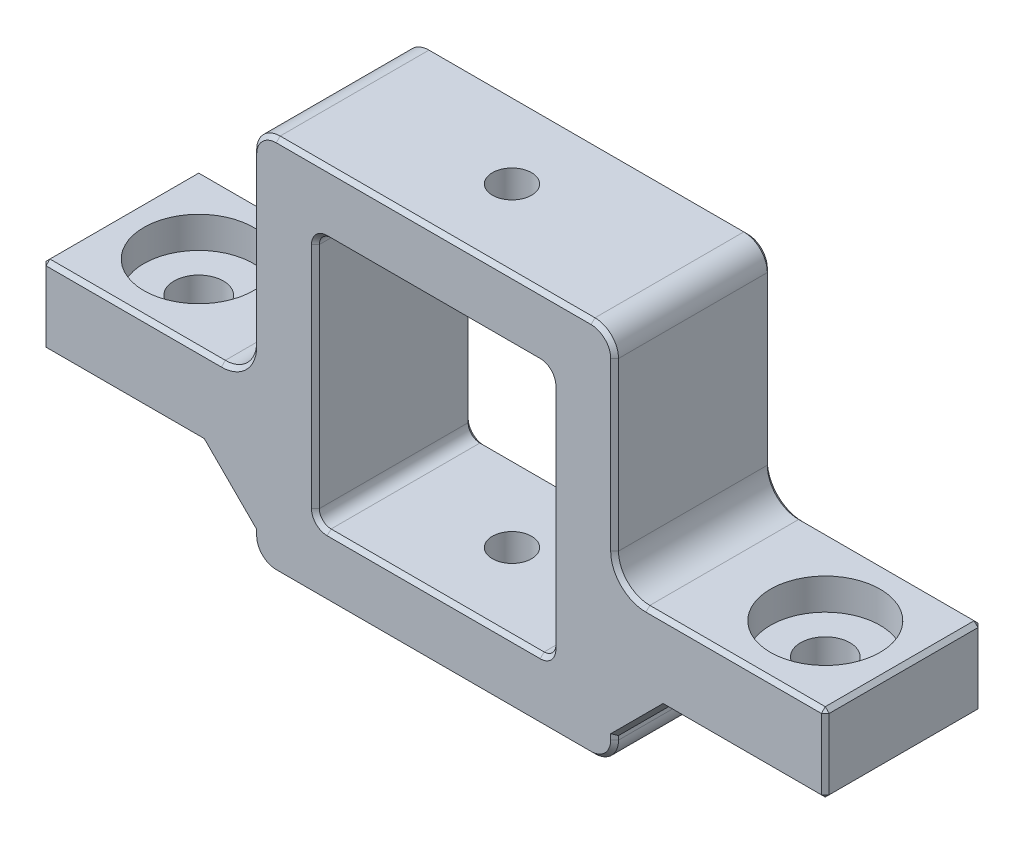
from build123d import *

# Parameters (mm, degrees)
SKETCH1_W           = 30.2
SKETCH1_H           = 32.2
BOSS_EXTRUDE1_DEPTH = 10
FILLET1_R           = 1.5
SKETCH3_R           = 3.15
CUT_EXTRUDE1_DEPTH  = 71.165803637
SKETCH6_W           = 53.8
SKETCH6_H           = 56.6
CUT_EXTRUDE4_DEPTH  = 59.998389809
SKETCH4_R           = 7
CUT_EXTRUDE2_DEPTH  = 32.3
FILLET2_R           = 3
FILLET3_R           = 4
CHAMFER1_SIZE       = 0.5
SKETCH5_R           = 2.5
CUT_EXTRUDE3_DEPTH  = 71.165803637


with BuildPart() as part:
    # Sketch1 → Boss-Extrude1 (new, symmetric)
    with BuildSketch(Plane.XY):
        Polygon((-50, -14.2), (-29.5, -14.2), (-23.1, -20.6), (-23.1, -24.1), (23.1, -24.1), (23.1, -20.6), (29.5, -14.2), (50, -14.2), (50, 24.1), (-50, 24.1), align=None)
        Rectangle(SKETCH1_W, SKETCH1_H, mode=Mode.SUBTRACT)
    extrude(amount=BOSS_EXTRUDE1_DEPTH, both=True)

    # Fillet1
    fillet1_edges = [part.edges().sort_by_distance(p)[0] for p in [
        (15.1, -16.1, 0),
        (15.1, 16.1, 0),
        (-15.1, 16.1, 0),
        (-15.1, -16.1, 0),
    ]]
    fillet(fillet1_edges, radius=FILLET1_R)

    # Sketch3 → Cut-Extrude1 (cut, through all)
    with BuildSketch(Plane(origin=(0, 24.1, 0), x_dir=(1, 0, 0), z_dir=(0, 1, 0))):
        with Locations(Location((-40, 0, 0), (0, 0, 270))):
            Circle(SKETCH3_R)
        with Locations(Location((40, 0, 0), (0, 0, 270))):
            Circle(SKETCH3_R)
    extrude(amount=-CUT_EXTRUDE1_DEPTH, mode=Mode.SUBTRACT)

    # Sketch6 → Cut-Extrude4 (cut, through all)
    with BuildSketch(Plane.XY.offset(10)):
        with Locations((-50, 24.1)):
            Rectangle(SKETCH6_W, SKETCH6_H)
        with Locations((50, 24.1)):
            Rectangle(SKETCH6_W, SKETCH6_H)
    extrude(amount=-CUT_EXTRUDE4_DEPTH, mode=Mode.SUBTRACT)

    # Sketch4 → Cut-Extrude2 (cut)
    with BuildSketch(Plane(origin=(0, 24.1, 0), x_dir=(1, 0, 0), z_dir=(0, 1, 0))):
        with Locations(Location((-40, 0, 0), (0, 0, 270))):
            Circle(SKETCH4_R)
        with Locations(Location((40, 0, 0), (0, 0, 270))):
            Circle(SKETCH4_R)
    extrude(amount=-CUT_EXTRUDE2_DEPTH, mode=Mode.SUBTRACT)

    # Fillet2
    fillet2_edges = [part.edges().sort_by_distance(p)[0] for p in [
        (23.1, -24.1, 0),
        (-23.1, -24.1, 0),
        (23.1, 24.1, 0),
        (-23.1, 24.1, 0),
    ]]
    fillet(fillet2_edges, radius=FILLET2_R)

    # Fillet3
    fillet3_edges = [part.edges().sort_by_distance(p)[0] for p in [
        (23.1, -4.2, 0),
        (-23.1, -4.2, 0),
    ]]
    fillet(fillet3_edges, radius=FILLET3_R)

    # Chamfer1
    chamfer1_edges = [part.edges().sort_by_distance(p)[0] for p in [
        (50, -4.2, 0),
        (50, -9.2, -10),
        (39.75, -14.2, -10),
        (26.3, -17.4, -10),
        (-23.1, -20.85, -10),
        (-26.3, -17.4, 10),
        (-26.3, -17.4, -10),
        (-39.75, -14.2, -10),
        (0, 24.1, -10),
        (0, 24.1, 10),
        (23.1, 10.45, -10),
        (23.1, -20.85, -10),
        (0, -24.1, -10),
        (-22.221320344, -23.221320344, -10),
        (22.221320344, -23.221320344, -10),
        (-22.221320344, 23.221320344, -10),
        (22.221320344, 23.221320344, -10),
        (23.1, 10.45, 10),
        (0, -24.1, 10),
        (23.1, -20.85, 10),
        (-22.221320344, -23.221320344, 10),
        (22.221320344, -23.221320344, 10),
        (-22.221320344, 23.221320344, 10),
        (22.221320344, 23.221320344, 10),
        (38.55, -4.2, -10),
        (38.55, -4.2, 10),
        (-23.1, 10.45, 10),
        (-23.1, 10.45, -10),
        (24.271572875, -3.028427125, 10),
        (-23.1, -20.85, 10),
        (24.271572875, -3.028427125, -10),
        (-24.271572875, -3.028427125, 10),
        (-24.271572875, -3.028427125, -10),
        (50, -14.2, 0),
        (-50, -14.2, 0),
        (26.3, -17.4, 10),
        (39.75, -14.2, 10),
        (50, -9.2, 10),
        (-15.1, 0, -10),
        (-15.1, 0, 10),
        (0, -16.1, -10),
        (0, -16.1, 10),
        (15.1, 0, -10),
        (15.1, 0, 10),
        (0, 16.1, -10),
        (0, 16.1, 10),
        (-14.660660172, -15.660660172, -10),
        (-14.660660172, -15.660660172, 10),
        (14.660660172, -15.660660172, -10),
        (14.660660172, -15.660660172, 10),
        (14.660660172, 15.660660172, -10),
        (14.660660172, 15.660660172, 10),
        (-14.660660172, 15.660660172, -10),
        (-14.660660172, 15.660660172, 10),
        (-50, -9.2, -10),
        (-50, -9.2, 10),
        (-38.55, -4.2, 10),
        (-39.75, -14.2, 10),
        (-50, -4.2, 0),
        (-38.55, -4.2, -10),
    ]]
    chamfer(chamfer1_edges, length=CHAMFER1_SIZE)

    # Sketch5 → Cut-Extrude3 (cut, through all)
    with BuildSketch(Plane(origin=(0, 24.1, 0), x_dir=(1, 0, 0), z_dir=(0, 1, 0))):
        with Locations(Location((0, 0, 0), (0, 0, 270))):
            Circle(SKETCH5_R)
    extrude(amount=-CUT_EXTRUDE3_DEPTH, mode=Mode.SUBTRACT)


solid = part.part
